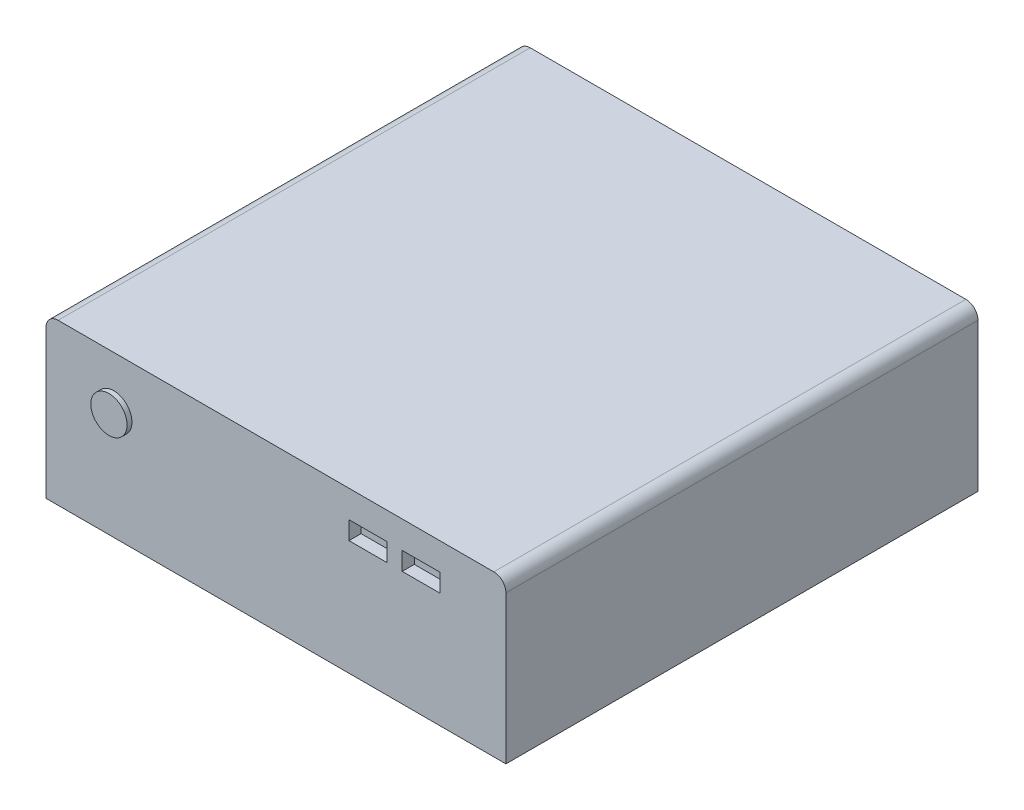
from build123d import *

# Parameters (mm, degrees)
SKETCH1_W           = 190
SKETCH1_H           = 195
BOSS_EXTRUDE1_DEPTH = 66.2
FILLET1_R           = 5
SKETCH2_R           = 1.7
CUT_EXTRUDE1_DEPTH  = 5
SKETCH3_R           = 7.5
BOSS_EXTRUDE2_DEPTH = 2
SKETCH4_W           = 15.7
SKETCH4_H           = 7.5
CUT_EXTRUDE2_DEPTH  = 5


with BuildPart() as part:
    # Sketch1 → Boss-Extrude1 (new body)
    with BuildSketch(Plane(origin=(0, 0, 0), x_dir=(1, 0, 0), z_dir=(0, 1, 0))):
        Rectangle(SKETCH1_W, SKETCH1_H)
    extrude(amount=BOSS_EXTRUDE1_DEPTH)

    # Fillet1
    fillet1_edges = [part.edges().sort_by_distance(p)[0] for p in [
        (-95, 66.2, 0),
        (95, 66.2, 0),
    ]]
    fillet(fillet1_edges, radius=FILLET1_R)

    # Sketch2 → Cut-Extrude1 (cut)
    with BuildSketch(Plane(origin=(0, 0, 0), x_dir=(-1, 0, 0), z_dir=(0, -1, 0))):
        with Locations(Location((85.725, -45, 0), (0, 0, 90))):
            Circle(SKETCH2_R)
        with Locations(Location((-85.725, -45, 0), (0, 0, 90))):
            Circle(SKETCH2_R)
        with Locations(Location((-85.725, 45, 0), (0, 0, 90))):
            Circle(SKETCH2_R)
        with Locations(Location((85.725, 45, 0), (0, 0, 90))):
            Circle(SKETCH2_R)
    extrude(amount=-CUT_EXTRUDE1_DEPTH, mode=Mode.SUBTRACT)

    # Sketch3 → Boss-Extrude2 (add)
    with BuildSketch(Plane.XY.offset(97.5)):
        with Locations(Location((-67, 45, 0), (0, 0, 180))):
            Circle(SKETCH3_R)
    extrude(amount=BOSS_EXTRUDE2_DEPTH)

    # Sketch4 → Cut-Extrude2 (cut)
    with BuildSketch(Plane.XY.offset(97.5)):
        with Locations((38, 51.2)):
            Rectangle(SKETCH4_W, SKETCH4_H)
        with Locations((60, 51.2)):
            Rectangle(SKETCH4_W, SKETCH4_H)
    extrude(amount=-CUT_EXTRUDE2_DEPTH, mode=Mode.SUBTRACT)


solid = part.part
